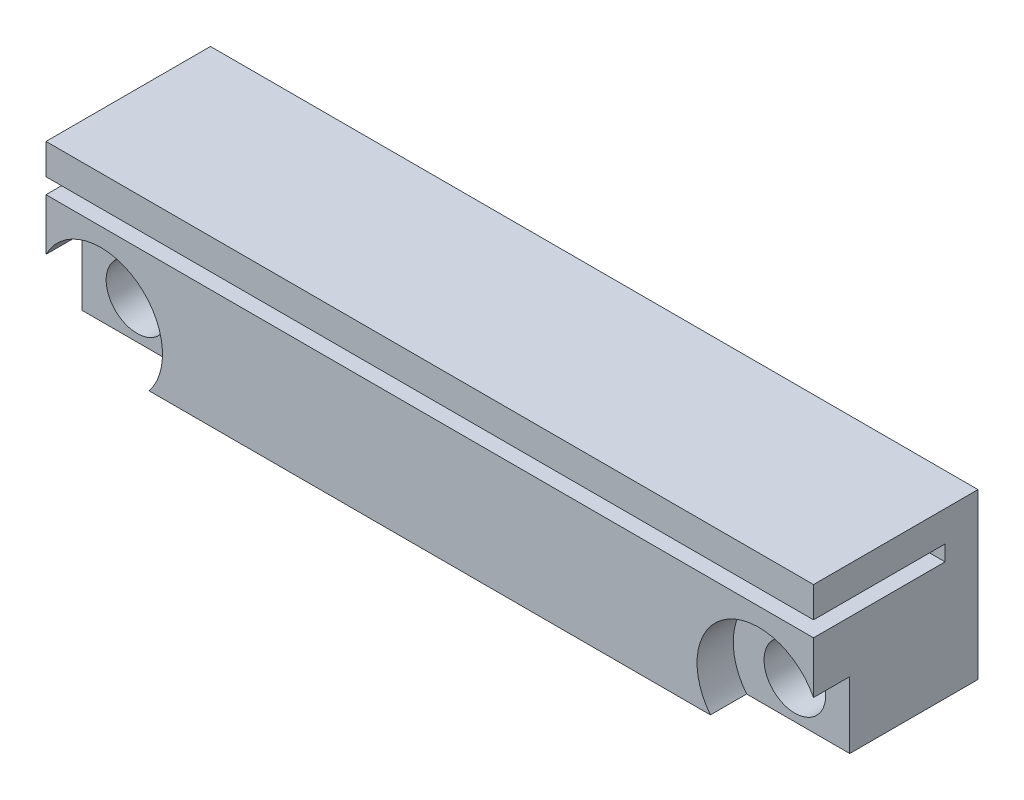
from build123d import *

# Parameters (mm, degrees)
SKETCH1_W                                            = 88.9
SKETCH1_H                                            = 19.05
BOSS_EXTRUDE1_DEPTH                                  = 19.05
CBORE_FOR_1_4_BINDING_HEAD_MACHINE_SCREW_D           = 7.14248
CBORE_FOR_1_4_BINDING_HEAD_MACHINE_SCREW_CBORE_D     = 14.2875
CBORE_FOR_1_4_BINDING_HEAD_MACHINE_SCREW_CBORE_DEPTH = 4.191
SKETCH5_W                                            = 98.267434004
SKETCH5_H                                            = 1.8
CUT_EXTRUDE1_DEPTH                                   = 15.24
SKETCH6_R                                            = 6.169746407
SKETCH6_R_2                                          = 8.762598039
CUT_EXTRUDE2_DEPTH                                   = 15.24


with BuildPart() as part:
    # Sketch1 → Boss-Extrude1 (new body)
    with BuildSketch(Plane.XY):
        Rectangle(SKETCH1_W, SKETCH1_H)
    extrude(amount=BOSS_EXTRUDE1_DEPTH)

    # CBORE for 1/4 Binding Head Machine Screw1 (through all)
    with Locations(Plane.XY.offset(19.05)):
        with Locations((-38.1, -5.08), (38.1, -5.08)):
            CounterBoreHole(CBORE_FOR_1_4_BINDING_HEAD_MACHINE_SCREW_D / 2, CBORE_FOR_1_4_BINDING_HEAD_MACHINE_SCREW_CBORE_D / 2, CBORE_FOR_1_4_BINDING_HEAD_MACHINE_SCREW_CBORE_DEPTH)

    # Sketch5 → Cut-Extrude1 (cut)
    with BuildSketch(Plane.XY.offset(19.05)):
        with Locations((0, 5.08)):
            Rectangle(SKETCH5_W, SKETCH5_H)
    extrude(amount=-CUT_EXTRUDE1_DEPTH, mode=Mode.SUBTRACT)

    # Sketch6 → Cut-Extrude2 (cut)
    with BuildSketch(Plane.XY.offset(14.859)):
        with Locations((-47.154600555, -9.207193904)):
            Circle(SKETCH6_R)
        with Locations((49.650008249, -12.821232633)):
            Circle(SKETCH6_R_2)
    extrude(amount=CUT_EXTRUDE2_DEPTH, mode=Mode.SUBTRACT)


solid = part.part
